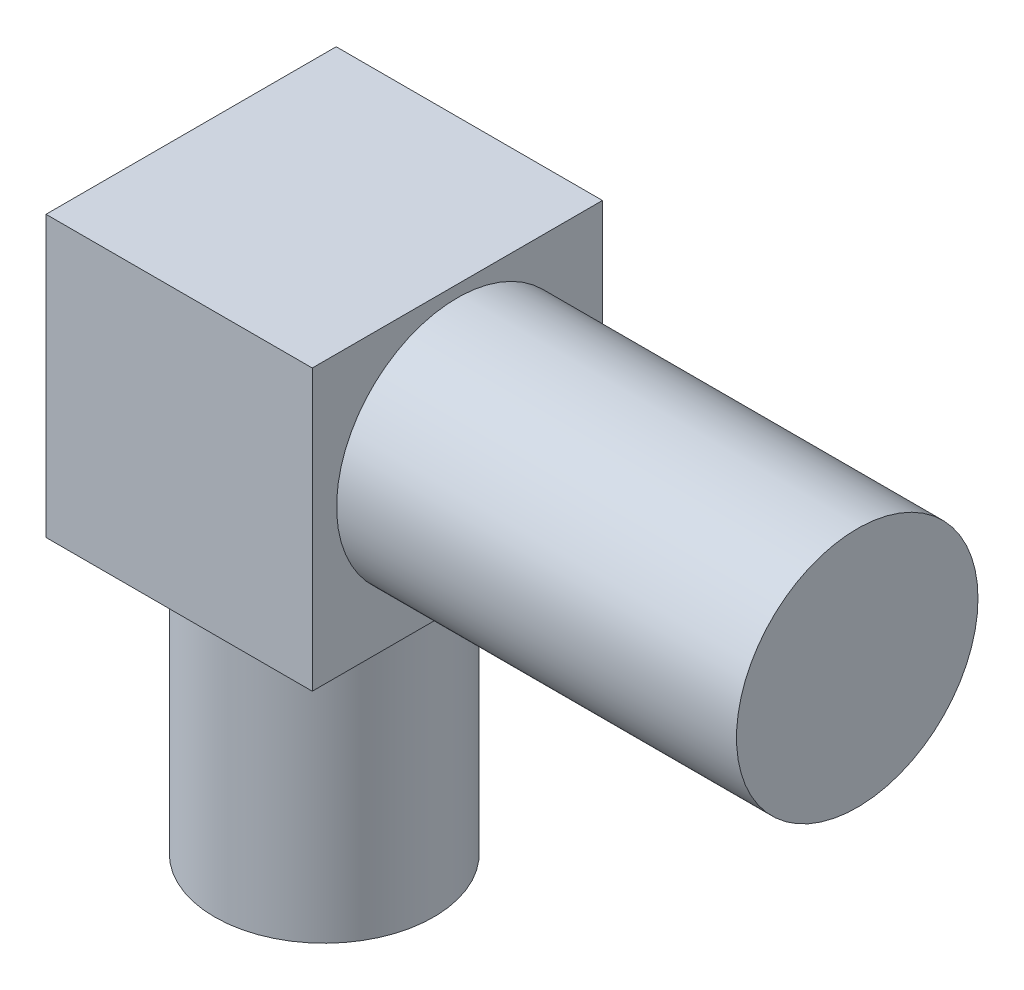
from build123d import *

# Parameters (mm, degrees)
SKETCH1_R           = 21.921131465
BOSS_EXTRUDE1_DEPTH = 56
SKETCH2_W           = 53.266946292
SKETCH2_H           = 58.053682116
BOSS_EXTRUDE2_DEPTH = 56
SKETCH3_R           = 24.156846208
BOSS_EXTRUDE3_DEPTH = 80


with BuildPart() as part:
    # Sketch1 → Boss-Extrude1 (new body)
    with BuildSketch(Plane(origin=(0, 0, 0), x_dir=(1, 0, 0), z_dir=(0, 1, 0))):
        with Locations(Location((0, 0, 0), (0, 0, 270))):
            Circle(SKETCH1_R)
    extrude(amount=BOSS_EXTRUDE1_DEPTH)

    # Sketch2 → Boss-Extrude2 (add)
    with BuildSketch(Plane(origin=(0, 56, 0), x_dir=(1, 0, 0), z_dir=(0, 1, 0))):
        Rectangle(SKETCH2_W, SKETCH2_H)
    extrude(amount=BOSS_EXTRUDE2_DEPTH)

    # Sketch3 → Boss-Extrude3 (add)
    with BuildSketch(Plane(origin=(26.633473146, 0, 0), x_dir=(0, 0, -1), z_dir=(1, 0, 0))):
        with Locations((0, 85.49534666)):
            Circle(SKETCH3_R)
    extrude(amount=BOSS_EXTRUDE3_DEPTH)


solid = part.part
